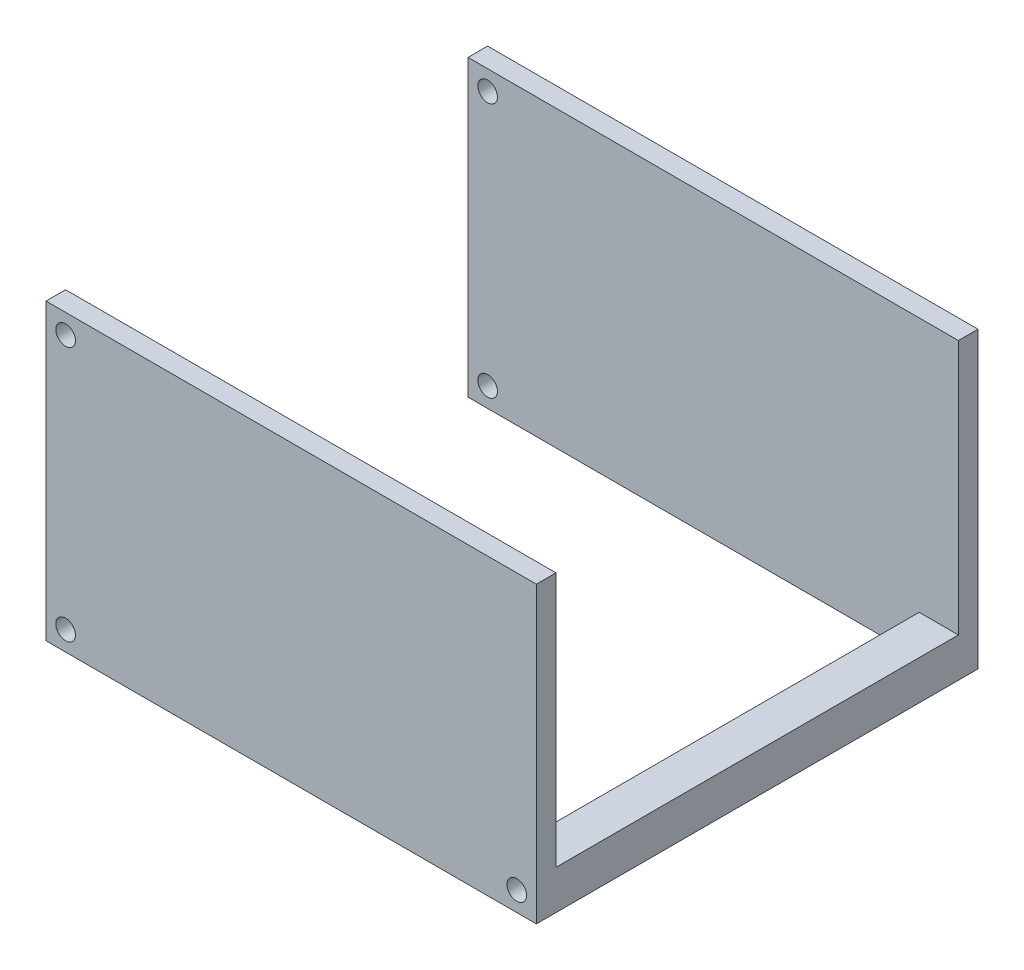
from build123d import *

# Parameters (mm, degrees)
SKETCH_1_W          = 50
SKETCH_1_H          = 30
SKETCH_1_R          = 1
EXTRUDE_1_DEPTH     = 45.03
SKETCH_2_W          = 46
SKETCH_2_H          = 41.03
CUT_EXTRUDE_1_DEPTH = 45.03
SKETCH_3_R          = 1
CUT_EXTRUDE_2_DEPTH = 45.03
SKETCH_4_W          = 4
SKETCH_4_H          = 41.03
CUT_EXTRUDE_3_DEPTH = 26


with BuildPart() as part:
    # 草图1 → 凸台-拉伸1 (new body)
    with BuildSketch(Plane.XY):
        Rectangle(SKETCH_1_W, SKETCH_1_H)
        with Locations((-23, -13)):
            Circle(SKETCH_1_R, mode=Mode.SUBTRACT)
        with Locations((-23, 13)):
            Circle(SKETCH_1_R, mode=Mode.SUBTRACT)
    extrude(amount=EXTRUDE_1_DEPTH)

    # 草图2 → 切除-拉伸1 (cut)
    with BuildSketch(Plane(origin=(0, 15, 0), x_dir=(1, 0, 0), z_dir=(0, 1, 0))):
        with Locations((-2, -22.515)):
            Rectangle(SKETCH_2_W, SKETCH_2_H)
    extrude(amount=-CUT_EXTRUDE_1_DEPTH, mode=Mode.SUBTRACT)

    # 草图3 → 切除-拉伸2 (cut)
    with BuildSketch(Plane.XY.offset(45.03)):
        with Locations((23, -13)):
            Circle(SKETCH_3_R)
    extrude(amount=-CUT_EXTRUDE_2_DEPTH, mode=Mode.SUBTRACT)

    # 草图4 → 切除-拉伸3 (cut)
    with BuildSketch(Plane(origin=(0, 15, 0), x_dir=(1, 0, 0), z_dir=(0, 1, 0))):
        with Locations((23, -22.515)):
            Rectangle(SKETCH_4_W, SKETCH_4_H)
    extrude(amount=-CUT_EXTRUDE_3_DEPTH, mode=Mode.SUBTRACT)


solid = part.part
